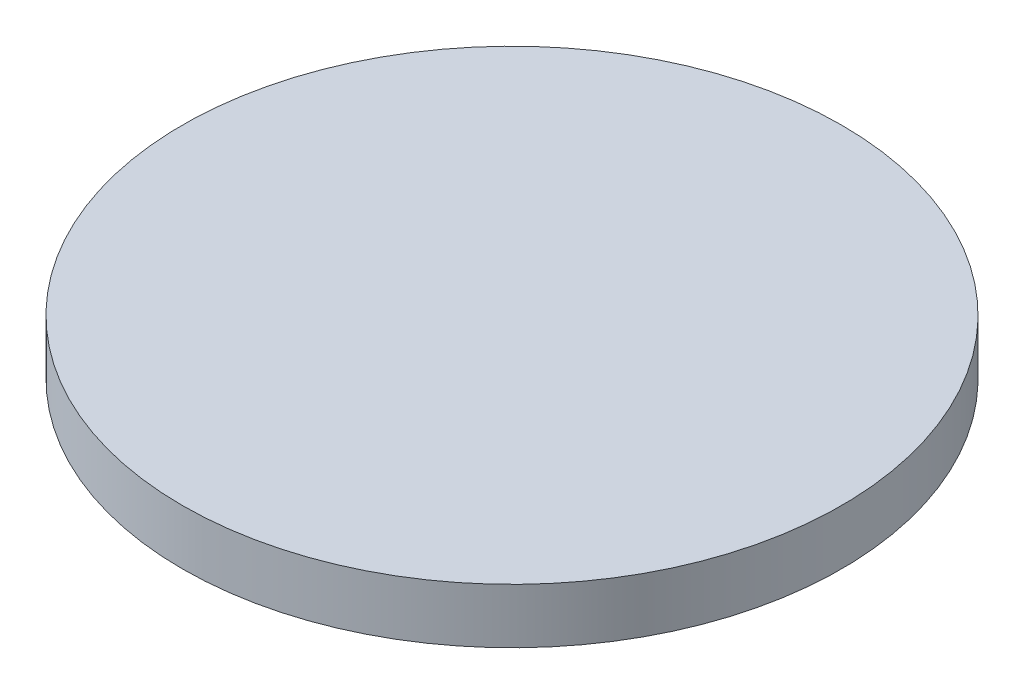
from build123d import *

# Parameters (mm, degrees)
SKETCH1_R           = 60
BOSS_EXTRUDE1_DEPTH = 10


with BuildPart() as part:
    # Sketch1 → Boss-Extrude1 (new body)
    with BuildSketch(Plane(origin=(0, 0, 0), x_dir=(1, 0, 0), z_dir=(0, 1, 0))):
        with Locations(Location((-30.600056827, 32.332135515, 0), (0, 0, 270))):
            Circle(SKETCH1_R)
    extrude(amount=BOSS_EXTRUDE1_DEPTH)


solid = part.part
